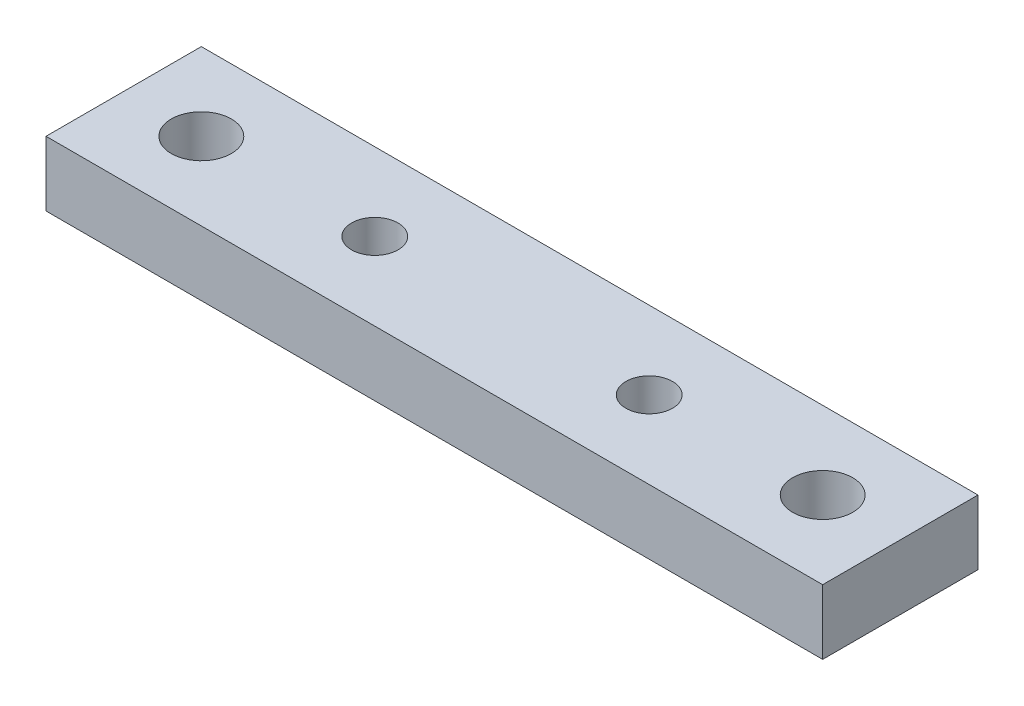
from build123d import *

# Parameters (mm, degrees)
SKETCH1_W           = 38.1
SKETCH1_H           = 7.62
SKETCH1_R           = 1.4732
SKETCH1_R_2         = 1.143
BOSS_EXTRUDE1_DEPTH = 3.175


with BuildPart() as part:
    # Sketch1 → Boss-Extrude1 (new body)
    with BuildSketch(Plane(origin=(0, 0, 0), x_dir=(1, 0, 0), z_dir=(0, 1, 0))):
        Rectangle(SKETCH1_W, SKETCH1_H)
        with Locations(Location((-15.24, 0, 0), (0, 0, 270))):
            Circle(SKETCH1_R, mode=Mode.SUBTRACT)
        with Locations(Location((-6.731, 0, 0), (0, 0, 270))):
            Circle(SKETCH1_R_2, mode=Mode.SUBTRACT)
        with Locations(Location((15.24, 0, 0), (0, 0, 90))):
            Circle(SKETCH1_R, mode=Mode.SUBTRACT)
        with Locations(Location((6.731, 0, 0), (0, 0, 90))):
            Circle(SKETCH1_R_2, mode=Mode.SUBTRACT)
    extrude(amount=BOSS_EXTRUDE1_DEPTH)


solid = part.part
